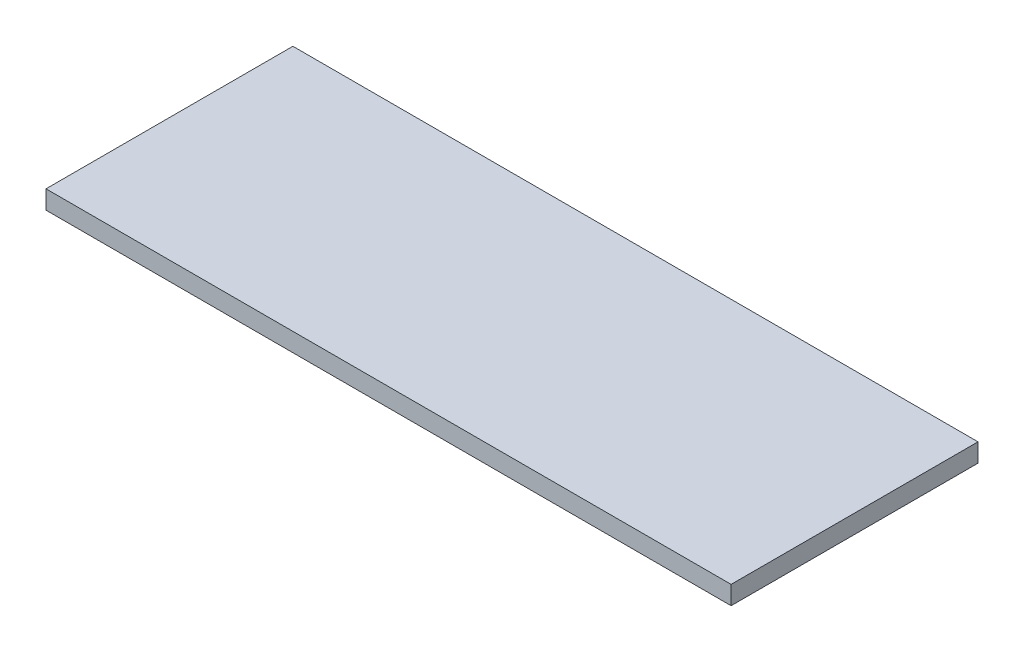
from build123d import *

# Parameters (mm, degrees)
SKETCH1_W   = 111
SKETCH1_H   = 3
PLATE_DEPTH = 40


with BuildPart() as part:
    # Sketch1 → Plate (new body)
    with BuildSketch(Plane.XY):
        with Locations((143.5, 0)):
            Rectangle(SKETCH1_W, SKETCH1_H)
    extrude(amount=PLATE_DEPTH)


solid = part.part
